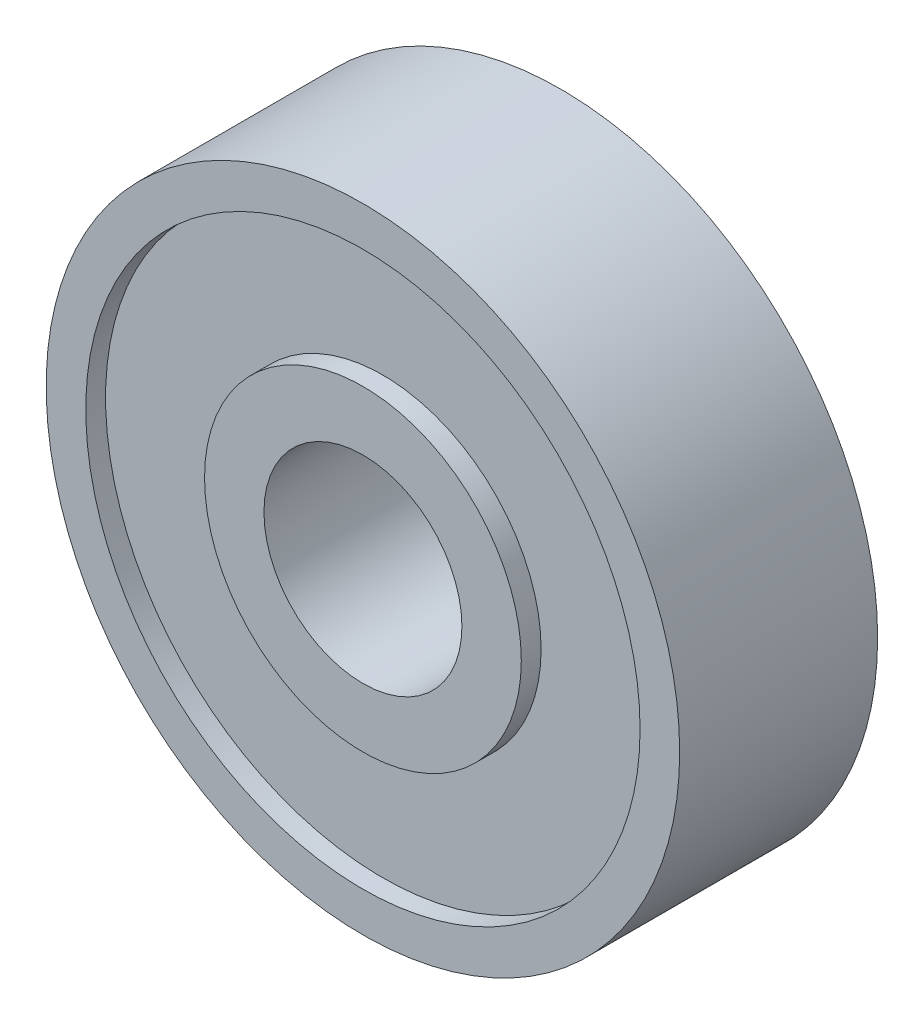
from build123d import *

# Parameters (mm, degrees)
ESQUISSE1_R             = 8
ESQUISSE1_R_2           = 7
BOSS_EXTRU_1_DEPTH      = 5
ESQUISSE1_3_R           = 7
ESQUISSE1_3_R_2         = 4
BOSS_EXTRU_2_DEPTH      = 4.5
ESQUISSE1_4_R           = 4
ESQUISSE1_4_R_2         = 2.5
BOSS_EXTRU_3_DEPTH      = 5
ESQUISSE2_R             = 7
ESQUISSE2_R_2           = 5
ENL_V_MAT_EXTRU_2_DEPTH = 0.5


with BuildPart() as part:
    # Esquisse1 → Boss.-Extru.1 (new body)
    with BuildSketch(Plane.XY):
        Circle(ESQUISSE1_R)
        Circle(ESQUISSE1_R_2, mode=Mode.SUBTRACT)
    extrude(amount=BOSS_EXTRU_1_DEPTH)

    # Esquisse1<3> → Boss.-Extru.2 (add)
    with BuildSketch(Plane.XY):
        Circle(ESQUISSE1_3_R)
        Circle(ESQUISSE1_3_R_2, mode=Mode.SUBTRACT)
    extrude(amount=BOSS_EXTRU_2_DEPTH)

    # Esquisse1<4> → Boss.-Extru.3 (add)
    with BuildSketch(Plane.XY):
        Circle(ESQUISSE1_4_R)
        Circle(ESQUISSE1_4_R_2, mode=Mode.SUBTRACT)
    extrude(amount=BOSS_EXTRU_3_DEPTH)

    # Esquisse2 → Enlèv. mat.-Extru.2 (cut)
    with BuildSketch(Plane(origin=(0, 0, 0), x_dir=(-1, 0, 0), z_dir=(0, 0, -1))):
        Circle(ESQUISSE2_R)
        Circle(ESQUISSE2_R_2, mode=Mode.SUBTRACT)
    extrude(amount=-ENL_V_MAT_EXTRU_2_DEPTH, mode=Mode.SUBTRACT)


solid = part.part
